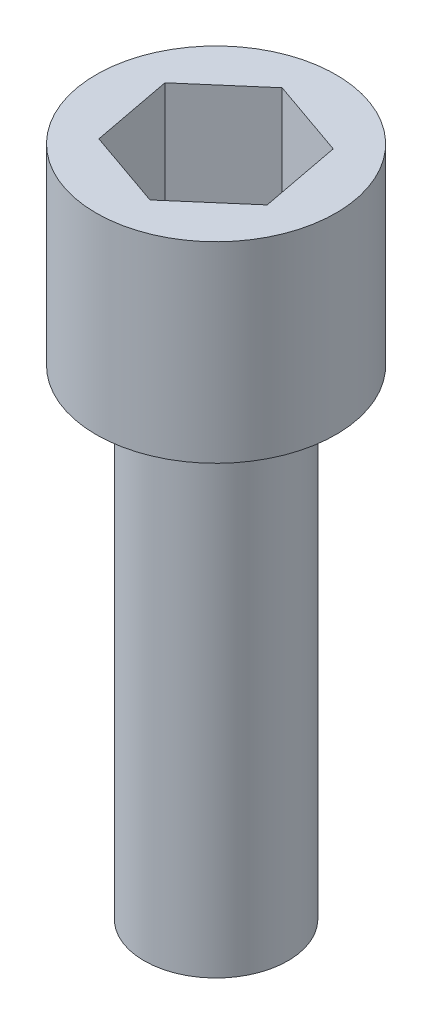
from build123d import *

# Parameters (mm, degrees)
ESQUISSE1_R             = 3
BOSS_EXTRU_2_DEPTH      = 20
ESQUISSE4_R             = 5
BOSS_EXTRU_5_DEPTH      = 8
ENL_V_MAT_EXTRU_3_DEPTH = 5


with BuildPart() as part:
    # Esquisse1 → Boss.-Extru.2 (new body)
    with BuildSketch(Plane(origin=(0, 0, 0), x_dir=(1, 0, 0), z_dir=(0, 1, 0))):
        with Locations(Location((0, 0, 0), (0, 0, 270))):
            Circle(ESQUISSE1_R)
    extrude(amount=BOSS_EXTRU_2_DEPTH)

    # Esquisse4 → Boss.-Extru.5 (add)
    with BuildSketch(Plane(origin=(0, 20, 0), x_dir=(1, 0, 0), z_dir=(0, 1, 0))):
        with Locations(Location((0, 0, 0), (0, 0, 270))):
            Circle(ESQUISSE4_R)
    extrude(amount=BOSS_EXTRU_5_DEPTH)

    # Esquisse6 → Enlèv. mat.-Extru.3 (cut)
    with BuildSketch(Plane(origin=(0, 28, 0), x_dir=(1, 0, 0), z_dir=(0, 1, 0))):
        Polygon((0.647967436, -3.402960212), (3.271033709, -1.140323845), (2.623066273, 2.262636366), (-0.647967436, 3.402960212), (-3.271033709, 1.140323845), (-2.623066273, -2.262636366), align=None)
    extrude(amount=-ENL_V_MAT_EXTRU_3_DEPTH, mode=Mode.SUBTRACT)


solid = part.part
